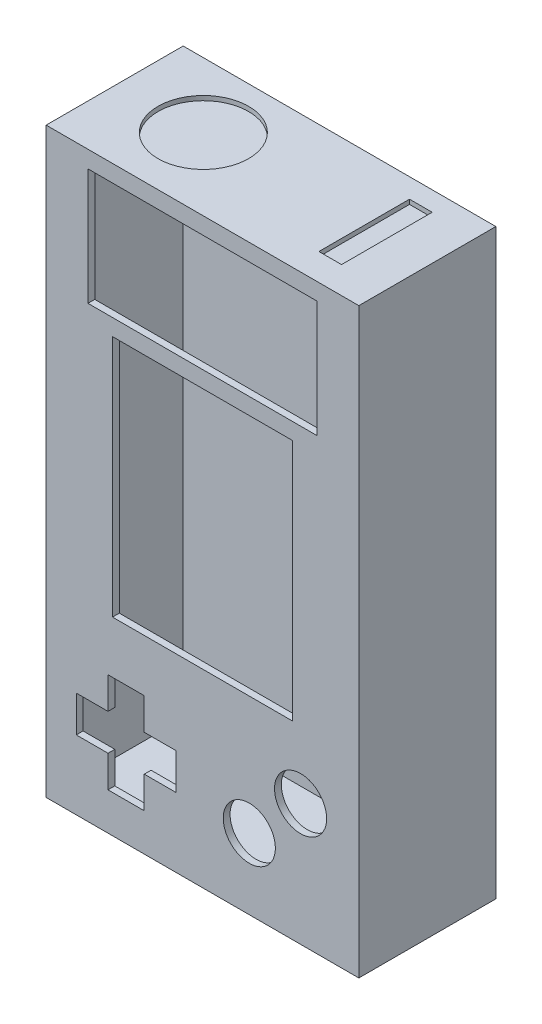
from build123d import *

# Parameters (mm, degrees)
SKETCH1_W           = 66
SKETCH1_H           = 125.5
SKETCH1_R           = 5.75
SKETCH1_W_2         = 50.55
SKETCH1_H_2         = 25.705
SKETCH1_W_3         = 39.72
SKETCH1_H_3         = 53.61
SKETCH1_W_4         = 42.72
SKETCH1_H_4         = 56.61
SKETCH1_W_5         = 53.55
SKETCH1_H_5         = 28.705
BOSS_EXTRUDE1_DEPTH = 1.5
SKETCH1_3_W         = 42.72
SKETCH1_3_H         = 56.61
SKETCH1_3_W_2       = 39.72
SKETCH1_3_H_2       = 53.61
BOSS_EXTRUDE2_DEPTH = 0.000481454
SKETCH1_4_W         = 53.55
SKETCH1_4_H         = 28.705
SKETCH1_4_W_2       = 50.55
SKETCH1_4_H_2       = 25.705
BOSS_EXTRUDE3_DEPTH = 0.000481454
BOSS_EXTRUDE4_START = -27.234481
SKETCH1_5_W         = 69
SKETCH1_5_H         = 128.5
SKETCH1_5_W_2       = 66
SKETCH1_5_H_2       = 125.5
BOSS_EXTRUDE4_DEPTH = 28.734481
BOSS_EXTRUDE5_START = -27.234481
SKETCH1_6_W         = 69
SKETCH1_6_H         = 128.5
BOSS_EXTRUDE5_DEPTH = 1.5
SKETCH2_R           = 10
SKETCH2_W           = 5
SKETCH2_H           = 20
CUT_EXTRUDE1_DEPTH  = 1


with BuildPart() as part:
    # Sketch1 → Boss-Extrude1 (new body)
    # profile 1 of 3: a face of its own
    with BuildSketch(Plane.XY):
        with Locations((16.854577092, 44.967543122)):
            Rectangle(SKETCH1_W, SKETCH1_H)
        with Locations((38.500244774, 7.618926737)):
            Circle(SKETCH1_R, mode=Mode.SUBTRACT)
        with Locations((27.186536275, -3.694781762)):
            Circle(SKETCH1_R, mode=Mode.SUBTRACT)
        with Locations((16.854577092, 92.618043122)):
            Rectangle(SKETCH1_W_2, SKETCH1_H_2, mode=Mode.SUBTRACT)
        with Locations((16.854577092, 49.317142331)):
            Rectangle(SKETCH1_W_3, SKETCH1_H_3, mode=Mode.SUBTRACT)
        Polygon((4, -11), (-4, -11), (-4, -4), (-11, -4), (-11, 4), (-4, 4), (-4, 11), (4, 11), (4, 4), (11, 4), (11, -4), (4, -4), align=None, mode=Mode.SUBTRACT)
    # profile 2 of 3: a face of its own
    with BuildSketch(Plane.XY):
        with Locations((16.854577092, 49.317142331)):
            Rectangle(SKETCH1_W_4, SKETCH1_H_4)
        with Locations((16.854577092, 49.317142331)):
            Rectangle(SKETCH1_W_3, SKETCH1_H_3, mode=Mode.SUBTRACT)
    # profile 3 of 3: a face of its own
    with BuildSketch(Plane.XY):
        with Locations((16.854577092, 92.618043122)):
            Rectangle(SKETCH1_W_5, SKETCH1_H_5)
        with Locations((16.854577092, 92.618043122)):
            Rectangle(SKETCH1_W_2, SKETCH1_H_2, mode=Mode.SUBTRACT)
    extrude(amount=BOSS_EXTRUDE1_DEPTH)

    # Sketch1<3> → Boss-Extrude2 (add)
    with BuildSketch(Plane.XY):
        with Locations((16.854577092, 49.317142331)):
            Rectangle(SKETCH1_3_W, SKETCH1_3_H)
        with Locations((16.854577092, 49.317142331)):
            Rectangle(SKETCH1_3_W_2, SKETCH1_3_H_2, mode=Mode.SUBTRACT)
    extrude(amount=-BOSS_EXTRUDE2_DEPTH)

    # Sketch1<4> → Boss-Extrude3 (add)
    with BuildSketch(Plane.XY):
        with Locations((16.854577092, 92.618043122)):
            Rectangle(SKETCH1_4_W, SKETCH1_4_H)
        with Locations((16.854577092, 92.618043122)):
            Rectangle(SKETCH1_4_W_2, SKETCH1_4_H_2, mode=Mode.SUBTRACT)
    extrude(amount=-BOSS_EXTRUDE3_DEPTH)

    # Sketch1<5> → Boss-Extrude4 (add)
    with BuildSketch(Plane.XY.offset(BOSS_EXTRUDE4_START)):
        with Locations((16.854577092, 44.967543122)):
            Rectangle(SKETCH1_5_W, SKETCH1_5_H)
        with Locations((16.854577092, 44.967543122)):
            Rectangle(SKETCH1_5_W_2, SKETCH1_5_H_2, mode=Mode.SUBTRACT)
    extrude(amount=BOSS_EXTRUDE4_DEPTH)

    # Sketch1<6> → Boss-Extrude5 (add)
    with BuildSketch(Plane.XY.offset(BOSS_EXTRUDE5_START)):
        with Locations((16.854577092, 44.967543122)):
            Rectangle(SKETCH1_6_W, SKETCH1_6_H)
    extrude(amount=-BOSS_EXTRUDE5_DEPTH)

    # Sketch2 → Cut-Extrude1 (cut)
    with BuildSketch(Plane(origin=(0, 109.217543122, 0), x_dir=(1, 0, 0), z_dir=(0, 1, 0))):
        with Locations(Location((1.104577092, 14.434481454, 0), (0, 0, 270))):
            Circle(SKETCH2_R)
        with Locations((39.104577092, 14.434481454)):
            Rectangle(SKETCH2_W, SKETCH2_H)
    extrude(amount=-CUT_EXTRUDE1_DEPTH, mode=Mode.SUBTRACT)


solid = part.part
